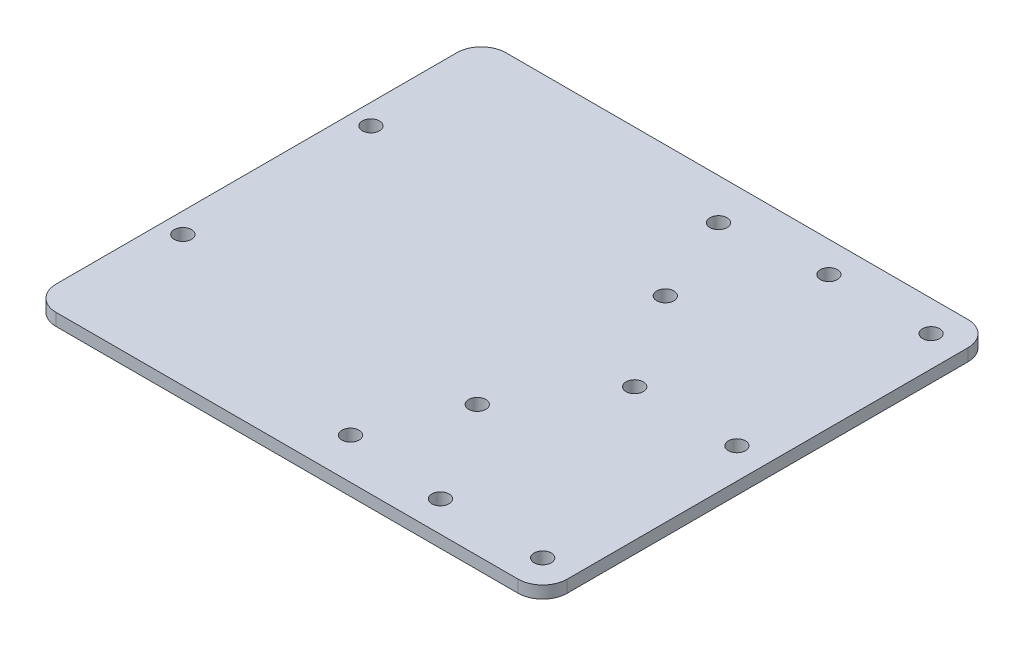
from build123d import *

# Parameters (mm, degrees)
EXTRUDE_1_DEPTH          = 3
SKETCH_2_R               = 2.1
CUT_EXTRUDE_1_DEPTH      = 127.066538846
SKETCH_3_R               = 2.1
CUT_EXTRUDE_2_DEPTH      = 127.066538846
CUT_EXTRUDE_3_DEPTH      = 127.066538846
CUT_EXTRUDE_3_DEPTH_BACK = 127.066538846
SKETCH_4_R               = 2.1


with BuildPart() as part:
    # 草图1 → 凸台-拉伸1 (new body)
    with BuildSketch(Plane(origin=(0, 0, 0), x_dir=(1, 0, 0), z_dir=(0, 1, 0))):
        with BuildLine():
            Line((-109.788244213, 42.110472219), (-109.788244213, -55.889527781))
            ThreePointArc((-109.788244213, -55.889527781), (-108.030884901, -60.132168469), (-103.788244213, -61.889527781))
            Line((-103.788244213, -61.889527781), (9.211755787, -61.889527781))
            ThreePointArc((9.211755787, -61.889527781), (13.454396474, -60.132168469), (15.211755787, -55.889527781))
            Line((15.211755787, -55.889527781), (15.211755787, 42.110472219))
            ThreePointArc((15.211755787, 42.110472219), (13.454396474, 46.353112906), (9.211755787, 48.110472219))
            Line((9.211755787, 48.110472219), (-103.788244213, 48.110472219))
            ThreePointArc((-103.788244213, 48.110472219), (-108.030884901, 46.353112906), (-109.788244213, 42.110472219))
        make_face()
    extrude(amount=EXTRUDE_1_DEPTH)

    # 草图2 → 切除-拉伸1 (cut, through all)
    with BuildSketch(Plane(origin=(0, 3, 0), x_dir=(1, 0, 0), z_dir=(0, 1, 0))):
        with Locations(Location((-17.288244213, -54.389527781, 0), (0, 0, 270))):
            Circle(SKETCH_2_R)
        with Locations(Location((7.711755787, -54.389527781, 0), (0, 0, 270))):
            Circle(SKETCH_2_R)
        with Locations(Location((-17.288244213, -6.889527781, 0), (0, 0, 270))):
            Circle(SKETCH_2_R)
        with Locations(Location((7.711755787, -6.889527781, 0), (0, 0, 270))):
            Circle(SKETCH_2_R)
        with Locations(Location((-17.288244213, 40.610472219, 0), (0, 0, 270))):
            Circle(SKETCH_2_R)
        with Locations(Location((7.711755787, 40.610472219, 0), (0, 0, 270))):
            Circle(SKETCH_2_R)
    extrude(amount=-CUT_EXTRUDE_1_DEPTH, mode=Mode.SUBTRACT)

    # 草图3 → 切除-拉伸2 (cut, through all)
    with BuildSketch(Plane(origin=(0, 3, 0), x_dir=(1, 0, 0), z_dir=(0, 1, 0))):
        with Locations(Location((-104.788244213, -29.889527781, 0), (0, 0, 270))):
            Circle(SKETCH_3_R)
        with Locations(Location((-104.788244213, 16.110472219, 0), (0, 0, 270))):
            Circle(SKETCH_3_R)
        with Locations(Location((-32.788244213, 16.110472219, 0), (0, 0, 270))):
            Circle(SKETCH_3_R)
        with Locations(Location((-32.788244213, -29.889527781, 0), (0, 0, 270))):
            Circle(SKETCH_3_R)
    extrude(amount=-CUT_EXTRUDE_2_DEPTH, mode=Mode.SUBTRACT)

    # 草图4 → 切除-拉伸3 (cut, two sides: drawn at the far end of the back side and taken through both)
    with BuildSketch(Plane(origin=(0, 3, 0), x_dir=(1, 0, 0), z_dir=(0, 1, 0)).offset(-CUT_EXTRUDE_3_DEPTH_BACK)):
        with Locations(Location((-41.788244213, -51.889527781, 0), (0, 0, 270))):
            Circle(SKETCH_4_R)
        with Locations(Location((-41.788244213, 38.110472219, 0), (0, 0, 270))):
            Circle(SKETCH_4_R)
    extrude(amount=CUT_EXTRUDE_3_DEPTH + CUT_EXTRUDE_3_DEPTH_BACK, mode=Mode.SUBTRACT)


solid = part.part
